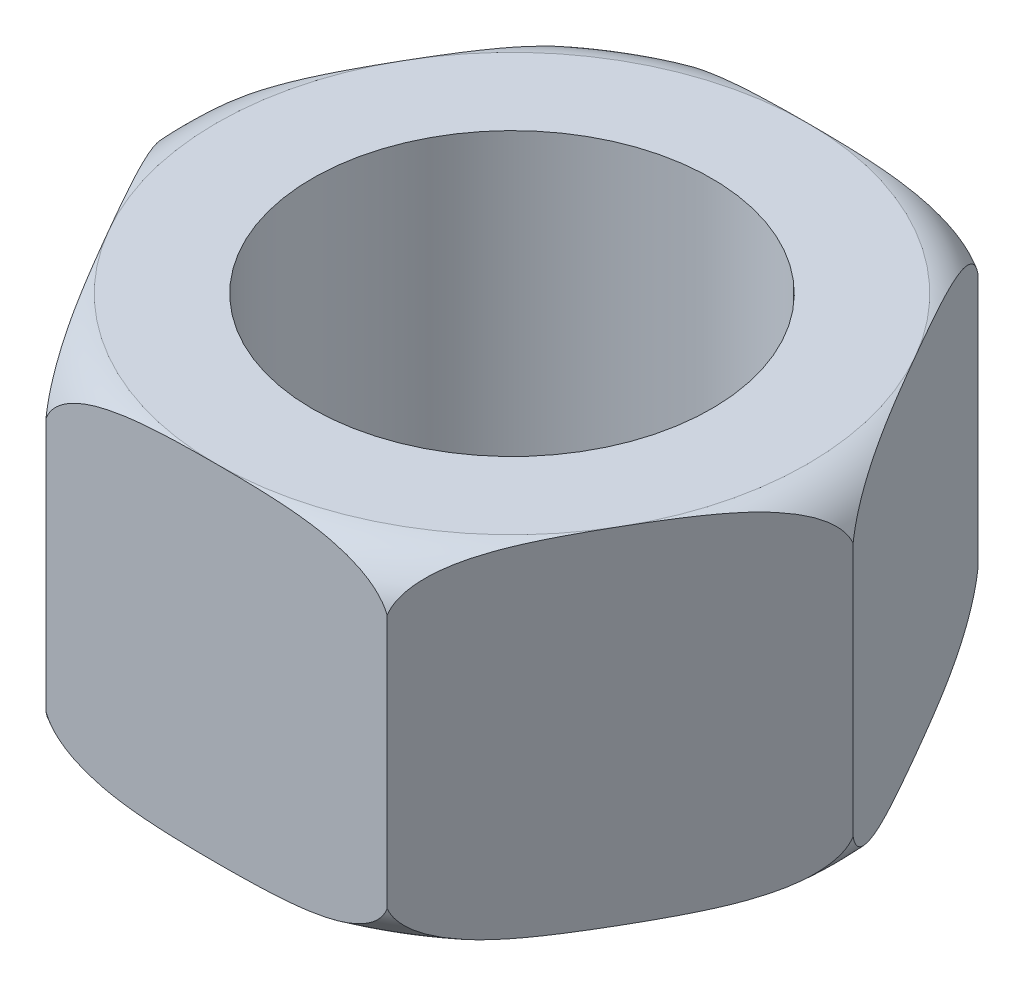
from build123d import *

# Parameters (mm, degrees)
SKETCH_1_R      = 10
EXTRUDE_1_DEPTH = 17.3


with BuildPart() as part:
    # 草图1 → 凸台-拉伸1 (new body)
    with BuildSketch(Plane(origin=(0, 0, 0), x_dir=(1, 0, 0), z_dir=(0, 1, 0))):
        Polygon((17.089567968, 0), (8.544783984, 14.8), (-8.544783984, 14.8), (-17.089567968, 0), (-8.544783984, -14.8), (8.544783984, -14.8), align=None)
        with Locations(Location((0, 0, 0), (0, 0, 270))):
            Circle(SKETCH_1_R, mode=Mode.SUBTRACT)
    extrude(amount=EXTRUDE_1_DEPTH)

    # 草图3 → 切除-旋转4 (revolve, cut)
    with BuildSketch(Plane(origin=(0, 0, 0), x_dir=(-0.5000000000000007, 0, -0.8660254037844383), z_dir=(0.8660254037844383, 0, -0.5000000000000007))):
        with BuildLine():
            Line((-14.8, 17.3), (-14.8, 17.928720004))
            Line((-14.8, 17.928720004), (-17.799472335, 17.928720004))
            Line((-17.799472335, 17.928720004), (-17.799472335, 15.010432032))
            Line((-17.799472335, 15.010432032), (-17.089567968, 15.010432032))
            ThreePointArc((-17.089567968, 15.010432032), (-16.301064282, 16.511496314), (-14.8, 17.3))
        make_face()
        with BuildLine():
            Line((-17.799472335, 2.289567968), (-17.089567968, 2.289567968))
            ThreePointArc((-17.089567968, 2.289567968), (-16.301064282, 0.788503686), (-14.8, 0))
            Line((-14.8, 0), (-14.8, -0.628720004))
            Line((-14.8, -0.628720004), (-17.799472335, -0.628720004))
            Line((-17.799472335, -0.628720004), (-17.799472335, 2.289567968))
        make_face()
    revolve(axis=Axis((0, 0, 0), (0, 1, 0)), mode=Mode.SUBTRACT)


solid = part.part
